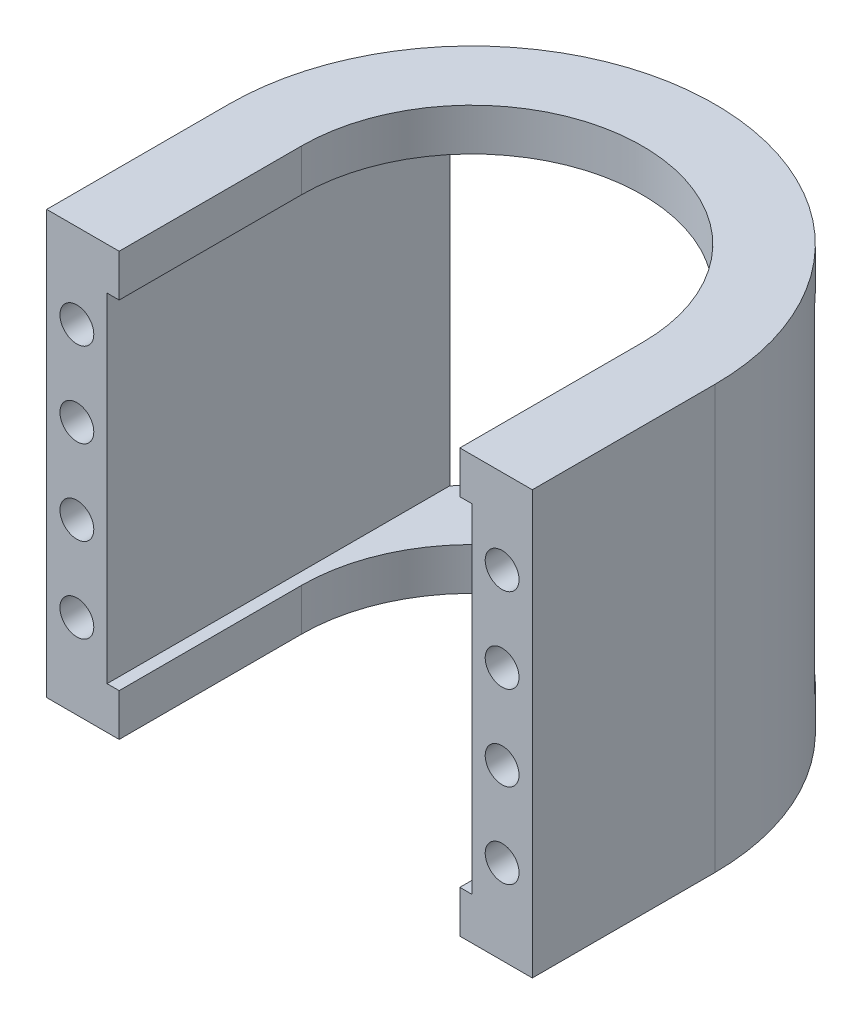
from build123d import *

# Parameters (mm, degrees)
BOSS_EXTRUDE1_DEPTH = 35
SKETCH2_W           = 30.2
SKETCH2_H           = 28
CUT_EXTRUDE1_DEPTH  = 54.554178175
BOSS_EXTRUDE2_START = -3.5
BOSS_EXTRUDE2_DEPTH = 3.5
BOSS_EXTRUDE3_DEPTH = 3.5
SKETCH6_R           = 1.4
CUT_EXTRUDE3_DEPTH  = 10


with BuildPart() as part:
    # Sketch1 → Boss-Extrude1 (new body)
    with BuildSketch(Plane(origin=(0, 0, 0), x_dir=(1, 0, 0), z_dir=(0, 1, 0))):
        with BuildLine():
            Line((15.1, 0), (15.1, -15.1))
            Line((15.1, -15.1), (20.1, -15.1))
            Line((20.1, -15.1), (20.1, 0))
            ThreePointArc((20.1, 0), (0, 20.1), (-20.1, 0))
            Line((-20.1, 0), (-20.1, -15.1))
            Line((-20.1, -15.1), (-15.1, -15.1))
            Line((-15.1, -15.1), (-15.1, 0))
            ThreePointArc((-15.1, 0), (0, 15.1), (15.1, 0))
        make_face()
    extrude(amount=BOSS_EXTRUDE1_DEPTH)

    # Sketch2 → Cut-Extrude1 (cut, through all)
    with BuildSketch(Plane.XY.offset(15.1)):
        with Locations((0, 17.5)):
            Rectangle(SKETCH2_W, SKETCH2_H)
    extrude(amount=-CUT_EXTRUDE1_DEPTH, mode=Mode.SUBTRACT)

    # Sketch3 → Boss-Extrude2 (add)
    with BuildSketch(Plane(origin=(0, 35, 0), x_dir=(1, 0, 0), z_dir=(0, 1, 0)).offset(BOSS_EXTRUDE2_START)):
        with BuildLine():
            Line((-15.1, 0), (-15.1, -15.1))
            Line((-15.1, -15.1), (-14.1, -15.1))
            Line((-14.1, -15.1), (-14.1, 0))
            ThreePointArc((-14.1, 0), (0, 14.1), (14.1, 0))
            Line((14.1, 0), (14.1, -15.1))
            Line((14.1, -15.1), (15.1, -15.1))
            Line((15.1, -15.1), (15.1, 0))
            ThreePointArc((15.1, 0), (0, 15.1), (-15.1, 0))
        make_face()
    extrude(amount=BOSS_EXTRUDE2_DEPTH)

    # Sketch4 → Boss-Extrude3 (add)
    with BuildSketch(Plane(origin=(0, 0, 0), x_dir=(-1, 0, 0), z_dir=(0, -1, 0))):
        with BuildLine():
            Line((15.1, 0), (15.1, -15.1))
            Line((15.1, -15.1), (14.1, -15.1))
            Line((14.1, -15.1), (14.1, 0))
            ThreePointArc((14.1, 0), (0, 14.1), (-14.1, 0))
            Line((-14.1, 0), (-14.1, -15.1))
            Line((-14.1, -15.1), (-15.1, -15.1))
            Line((-15.1, -15.1), (-15.1, 0))
            ThreePointArc((-15.1, 0), (0, 15.1), (15.1, 0))
        make_face()
    extrude(amount=-BOSS_EXTRUDE3_DEPTH)

    # Sketch6 → Cut-Extrude3 (cut)
    with BuildSketch(Plane.XY.offset(15.1)):
        with Locations((-17.6, 28)):
            Circle(SKETCH6_R)
        with Locations((17.6, 28)):
            Circle(SKETCH6_R)
        with Locations((17.6, 21)):
            Circle(SKETCH6_R)
        with Locations((17.6, 14)):
            Circle(SKETCH6_R)
        with Locations((17.6, 7)):
            Circle(SKETCH6_R)
        with Locations((-17.6, 21)):
            Circle(SKETCH6_R)
        with Locations((-17.6, 14)):
            Circle(SKETCH6_R)
        with Locations((-17.6, 7)):
            Circle(SKETCH6_R)
    extrude(amount=-CUT_EXTRUDE3_DEPTH, mode=Mode.SUBTRACT)


solid = part.part
